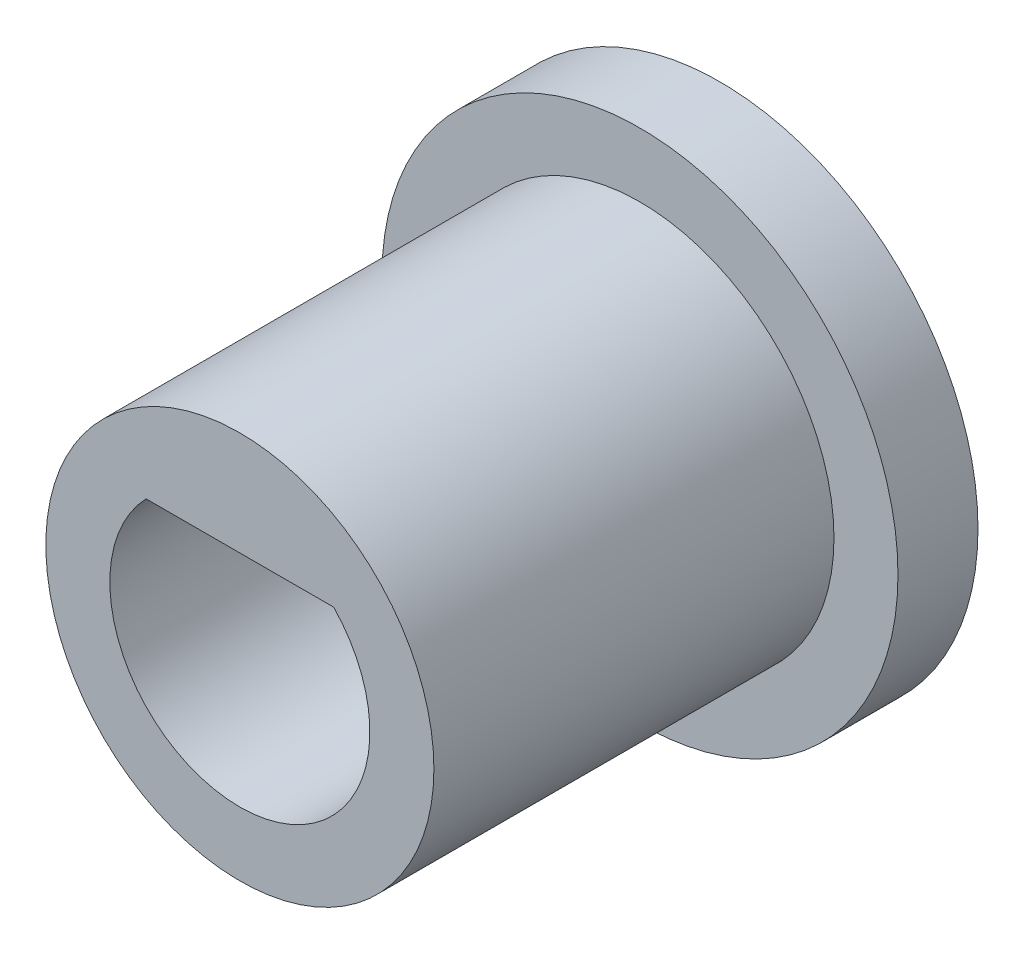
from build123d import *

# Parameters (mm, degrees)
SKETCH1_R           = 2.425
BOSS_EXTRUDE1_DEPTH = 5
BOSS_EXTRUDE2_START = -1
SKETCH1_4_R         = 3.225
BOSS_EXTRUDE2_DEPTH = 1


with BuildPart() as part:
    # Sketch1 → Boss-Extrude1 (new body)
    with BuildSketch(Plane.XY):
        Circle(SKETCH1_R)
        with BuildLine():
            Line((-1.17260394, 1.125), (1.17260394, 1.125))
            ThreePointArc((1.17260394, 1.125), (0, -1.625), (-1.17260394, 1.125))
        make_face(mode=Mode.SUBTRACT)
    extrude(amount=BOSS_EXTRUDE1_DEPTH)

    # Sketch1<4> → Boss-Extrude2 (add)
    with BuildSketch(Plane.XY.offset(BOSS_EXTRUDE2_START)):
        Circle(SKETCH1_4_R)
        with BuildLine():
            Line((-1.17260394, 1.125), (1.17260394, 1.125))
            ThreePointArc((1.17260394, 1.125), (0, -1.625), (-1.17260394, 1.125))
        make_face(mode=Mode.SUBTRACT)
    extrude(amount=BOSS_EXTRUDE2_DEPTH)


solid = part.part
